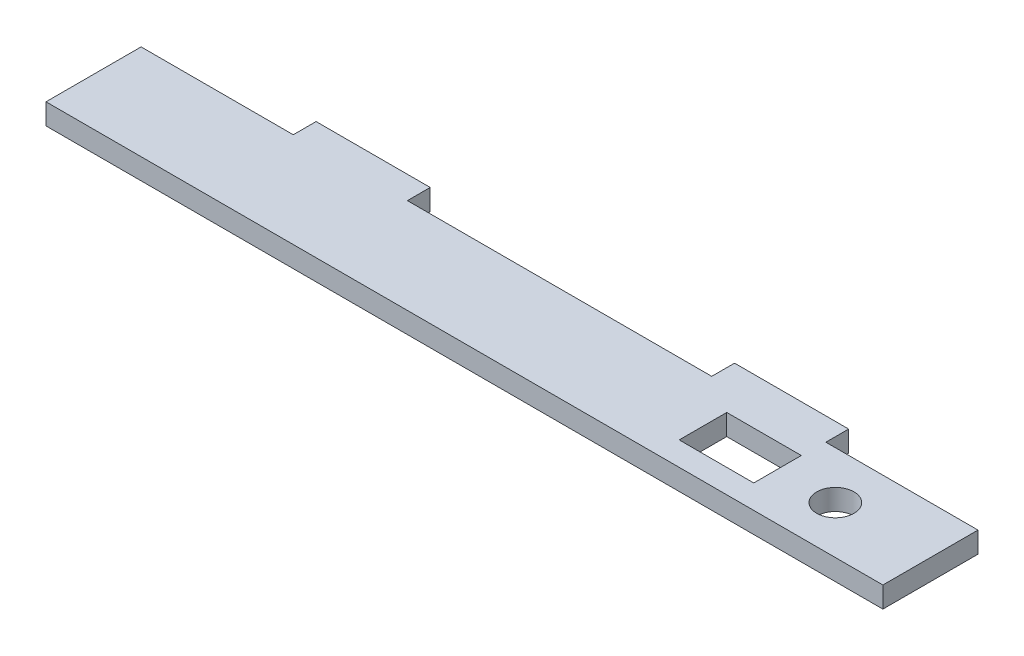
from build123d import *

# Parameters (mm, degrees)
SKETCH1_W           = 30
SKETCH1_H           = 6
SKETCH1_W_2         = 220
SKETCH1_H_2         = 25
BOSS_EXTRUDE1_DEPTH = 5.5
SKETCH2_R           = 4.9
SKETCH2_W           = 19.6
SKETCH2_H           = 12.5
CUT_EXTRUDE1_DEPTH  = 112.680347421


with BuildPart() as part:
    # Sketch1 → Boss-Extrude1 (new body)
    with BuildSketch(Plane(origin=(0, 0, 0), x_dir=(1, 0, 0), z_dir=(0, 1, 0))):
        with Locations((-55, 15.5)):
            Rectangle(SKETCH1_W, SKETCH1_H)
        Rectangle(SKETCH1_W_2, SKETCH1_H_2)
        with Locations((55, 15.5)):
            Rectangle(SKETCH1_W, SKETCH1_H)
    extrude(amount=BOSS_EXTRUDE1_DEPTH)

    # Sketch2 → Cut-Extrude1 (cut, through all)
    with BuildSketch(Plane(origin=(0, 5.5, 0), x_dir=(1, 0, 0), z_dir=(0, 1, 0))):
        with Locations(Location((85, 0, 0), (0, 0, 270))):
            Circle(SKETCH2_R)
        with Locations((60, 0)):
            Rectangle(SKETCH2_W, SKETCH2_H)
    extrude(amount=-CUT_EXTRUDE1_DEPTH, mode=Mode.SUBTRACT)


solid = part.part
